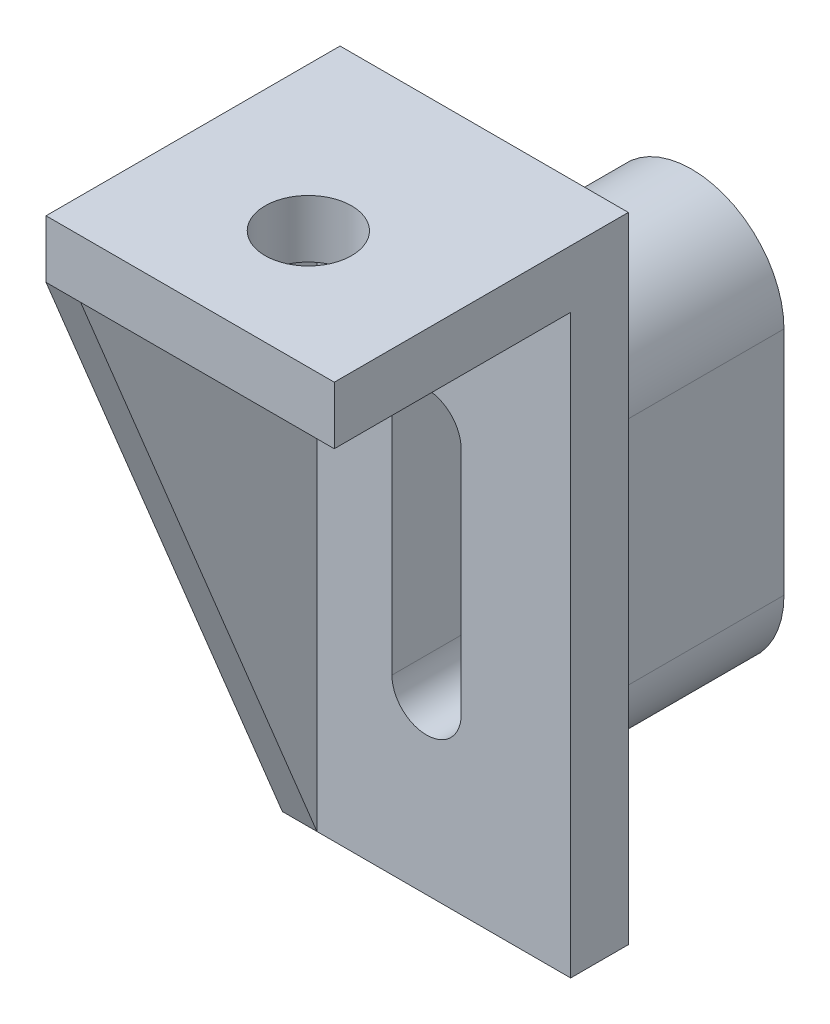
from build123d import *

# Parameters (mm, degrees)
SKETCH_1_W          = 50
SKETCH_1_H          = 100
EXTRUDE_1_DEPTH     = 10
EXTRUDE_START       = -36
EXTRUDE_2_DEPTH     = 36
SKETCH_2_W          = 50
SKETCH_2_H          = 10
EXTRUDE_3_DEPTH     = 51
SKETCH_3_R          = 7.5
CUT_EXTRUDE_1_DEPTH = 116.004347744
EXTRUDE_4_DEPTH     = 6


with BuildPart() as part:
    # Эскиз1 → Бобышка-Вытянуть1 (new body)
    with BuildSketch(Plane.XY):
        Rectangle(SKETCH_1_W, SKETCH_1_H)
        with BuildLine():
            ThreePointArc((6, -20), (0, -26), (-6, -20))
            Line((-6, -20), (-6, 20))
            ThreePointArc((-6, 20), (0, 26), (6, 20))
            Line((6, 20), (6, -20))
        make_face(mode=Mode.SUBTRACT)
    extrude(amount=EXTRUDE_1_DEPTH)

    # Эскиз1<3> → Бобышка-Вытянуть2 (add)
    with BuildSketch(Plane.XY.offset(EXTRUDE_START)):
        with BuildLine():
            Line((-16, 20), (-16, -20))
            ThreePointArc((-16, -20), (0, -36), (16, -20))
            Line((16, -20), (16, 20))
            ThreePointArc((16, 20), (0, 36), (-16, 20))
        make_face()
        with BuildLine():
            ThreePointArc((6, -20), (0, -26), (-6, -20))
            Line((-6, -20), (-6, 20))
            ThreePointArc((-6, 20), (0, 26), (6, 20))
            Line((6, 20), (6, -20))
        make_face(mode=Mode.SUBTRACT)
    extrude(amount=EXTRUDE_2_DEPTH)

    # Эскиз2 → Бобышка-Вытянуть3 (add)
    with BuildSketch(Plane(origin=(0, 0, 0), x_dir=(-1, 0, 0), z_dir=(0, 0, -1))):
        with Locations((0, 55)):
            Rectangle(SKETCH_2_W, SKETCH_2_H)
    extrude(amount=-EXTRUDE_3_DEPTH)

    # Эскиз3 → Вырез-Вытянуть1 (cut, through all)
    with BuildSketch(Plane.XZ.offset(-50)):
        with Locations((0, 30.5)):
            Circle(SKETCH_3_R)
    extrude(amount=-CUT_EXTRUDE_1_DEPTH, mode=Mode.SUBTRACT)

    # Эскиз4 → Бобышка-Вытянуть4 (add)
    with BuildSketch(Plane.ZY.offset(25)):
        Polygon((51, 50), (10, -50), (10, 50), align=None)
    extrude(amount=-EXTRUDE_4_DEPTH)


solid = part.part
